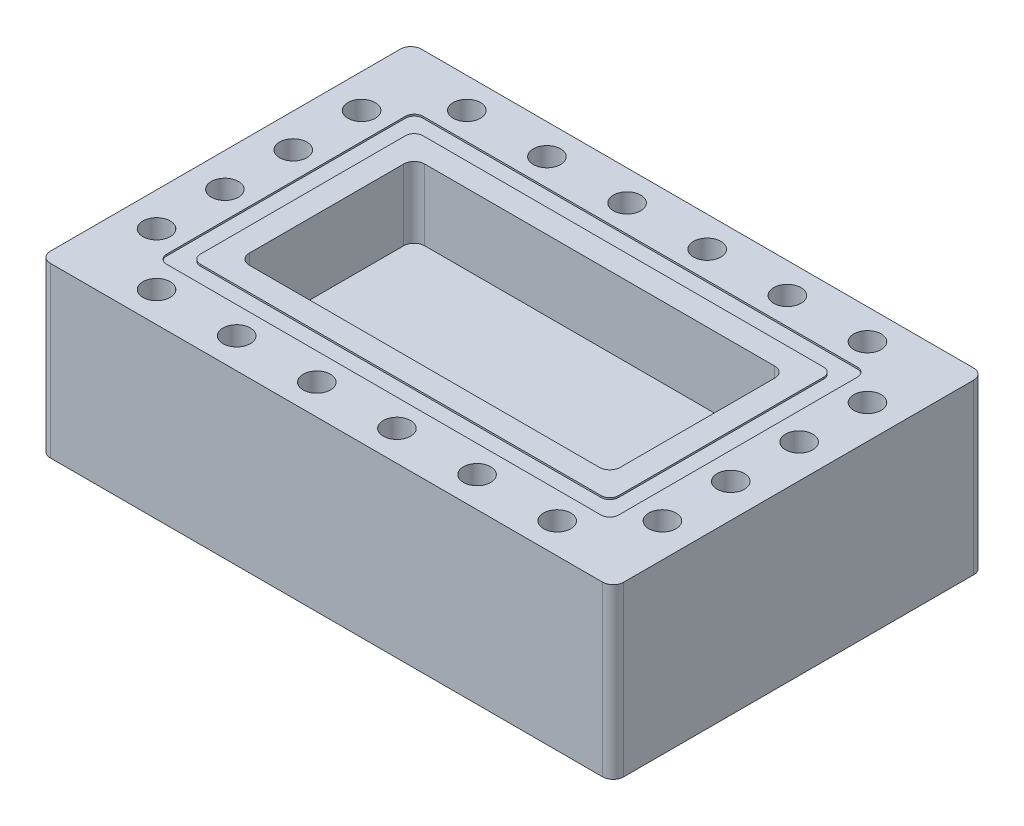
from build123d import *

# Parameters (mm, degrees)
SKETCH1_W           = 85
SKETCH1_H           = 55
BOSS_EXTRUDE1_DEPTH = 25
SKETCH2_W           = 55
SKETCH2_H           = 26
CUT_EXTRUDE1_DEPTH  = 10.5
FILLET1_R           = 1.55
SKETCH3_W           = 67
SKETCH3_H           = 38
SKETCH3_W_2         = 62
SKETCH3_H_2         = 33
CUT_EXTRUDE2_DEPTH  = 0.25
FILLET2_R           = 1.3
SKETCH5_R           = 2.025
CUT_EXTRUDE4_DEPTH  = 105.283268073


with BuildPart() as part:
    # Sketch1 → Boss-Extrude1 (new body)
    with BuildSketch(Plane(origin=(0, 0, 0), x_dir=(1, 0, 0), z_dir=(0, 1, 0))):
        with Locations((42.5, 27.5)):
            Rectangle(SKETCH1_W, SKETCH1_H)
    extrude(amount=BOSS_EXTRUDE1_DEPTH)

    # Sketch2 → Cut-Extrude1 (cut)
    with BuildSketch(Plane(origin=(0, 25, 0), x_dir=(1, 0, 0), z_dir=(0, 1, 0))):
        with Locations((42.5, 27.5)):
            Rectangle(SKETCH2_W, SKETCH2_H)
    extrude(amount=-CUT_EXTRUDE1_DEPTH, mode=Mode.SUBTRACT)

    # Fillet1
    fillet1_edges = [part.edges().sort_by_distance(p)[0] for p in [
        (15, 19.75, -14.5),
        (15, 19.75, -40.5),
        (70, 19.75, -40.5),
        (70, 19.75, -14.5),
        (0, 12.5, -55),
        (85, 12.5, -55),
        (85, 12.5, 0),
        (0, 12.5, 0),
    ]]
    fillet(fillet1_edges, radius=FILLET1_R)

    # Sketch3 → Cut-Extrude2 (cut)
    with BuildSketch(Plane(origin=(0, 25, 0), x_dir=(1, 0, 0), z_dir=(0, 1, 0))):
        with Locations((42.5, 27.5)):
            Rectangle(SKETCH3_W, SKETCH3_H)
        with Locations((42.5, 27.5)):
            Rectangle(SKETCH3_W_2, SKETCH3_H_2, mode=Mode.SUBTRACT)
    extrude(amount=-CUT_EXTRUDE2_DEPTH, mode=Mode.SUBTRACT)

    # Fillet2
    fillet2_edges = [part.edges().sort_by_distance(p)[0] for p in [
        (9, 24.875, -8.5),
        (9, 24.875, -46.5),
        (76, 24.875, -46.5),
        (76, 24.875, -8.5),
        (11.5, 24.875, -44),
        (73.5, 24.875, -44),
        (73.5, 24.875, -11),
        (11.5, 24.875, -11),
    ]]
    fillet(fillet2_edges, radius=FILLET2_R)

    # Sketch5 → Cut-Extrude4 (cut, through all)
    with BuildSketch(Plane(origin=(0, 25, 0), x_dir=(1, 0, 0), z_dir=(0, 1, 0))):
        with Locations(Location((5, 42.7, 0), (0, 0, 270))):
            Circle(SKETCH5_R)
        with Locations(Location((5, 12.3, 0), (0, 0, 270))):
            Circle(SKETCH5_R)
        with Locations(Location((12.8, 4.5, 0), (0, 0, 270))):
            Circle(SKETCH5_R)
        with Locations(Location((72.2, 4.5, 0), (0, 0, 270))):
            Circle(SKETCH5_R)
        with Locations(Location((24.68, 4.5, 0), (0, 0, 270))):
            Circle(SKETCH5_R)
        with Locations(Location((36.56, 4.5, 0), (0, 0, 270))):
            Circle(SKETCH5_R)
        with Locations(Location((48.44, 4.5, 0), (0, 0, 270))):
            Circle(SKETCH5_R)
        with Locations(Location((60.32, 4.5, 0), (0, 0, 270))):
            Circle(SKETCH5_R)
        with Locations(Location((5, 32.566666667, 0), (0, 0, 270))):
            Circle(SKETCH5_R)
        with Locations(Location((5, 22.433333333, 0), (0, 0, 270))):
            Circle(SKETCH5_R)
        with Locations(Location((80, 42.7, 0), (0, 0, 270))):
            Circle(SKETCH5_R)
        with Locations(Location((80, 12.3, 0), (0, 0, 270))):
            Circle(SKETCH5_R)
        with Locations(Location((80, 22.433333333, 0), (0, 0, 270))):
            Circle(SKETCH5_R)
        with Locations(Location((80, 32.566666667, 0), (0, 0, 270))):
            Circle(SKETCH5_R)
        with Locations(Location((12.8, 50.5, 0), (0, 0, 270))):
            Circle(SKETCH5_R)
        with Locations(Location((24.68, 50.5, 0), (0, 0, 270))):
            Circle(SKETCH5_R)
        with Locations(Location((36.56, 50.5, 0), (0, 0, 270))):
            Circle(SKETCH5_R)
        with Locations(Location((48.44, 50.5, 0), (0, 0, 270))):
            Circle(SKETCH5_R)
        with Locations(Location((60.32, 50.5, 0), (0, 0, 270))):
            Circle(SKETCH5_R)
        with Locations(Location((72.2, 50.5, 0), (0, 0, 270))):
            Circle(SKETCH5_R)
    extrude(amount=-CUT_EXTRUDE4_DEPTH, mode=Mode.SUBTRACT)


solid = part.part
